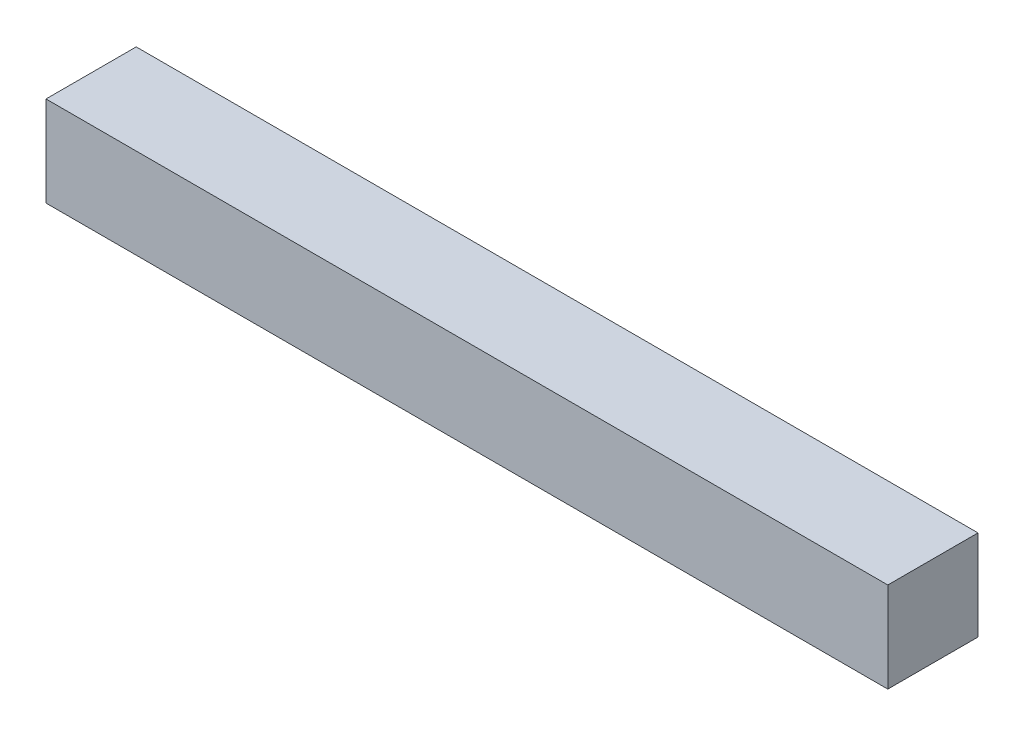
from build123d import *

# Parameters (mm, degrees)
KAP_ON_CEKME_DUDAGI_1_START = -5
SKETCH1_W                   = 140
SKETCH1_H                   = 15
KAP_ON_CEKME_DUDAGI_1_DEPTH = 15


with BuildPart() as part:
    # Sketch1 → KAP_on_cekme_dudagi_1 (new body)
    with BuildSketch(Plane.XY.offset(KAP_ON_CEKME_DUDAGI_1_START)):
        with Locations((0, 252.5)):
            Rectangle(SKETCH1_W, SKETCH1_H)
    extrude(amount=-KAP_ON_CEKME_DUDAGI_1_DEPTH)


solid = part.part
